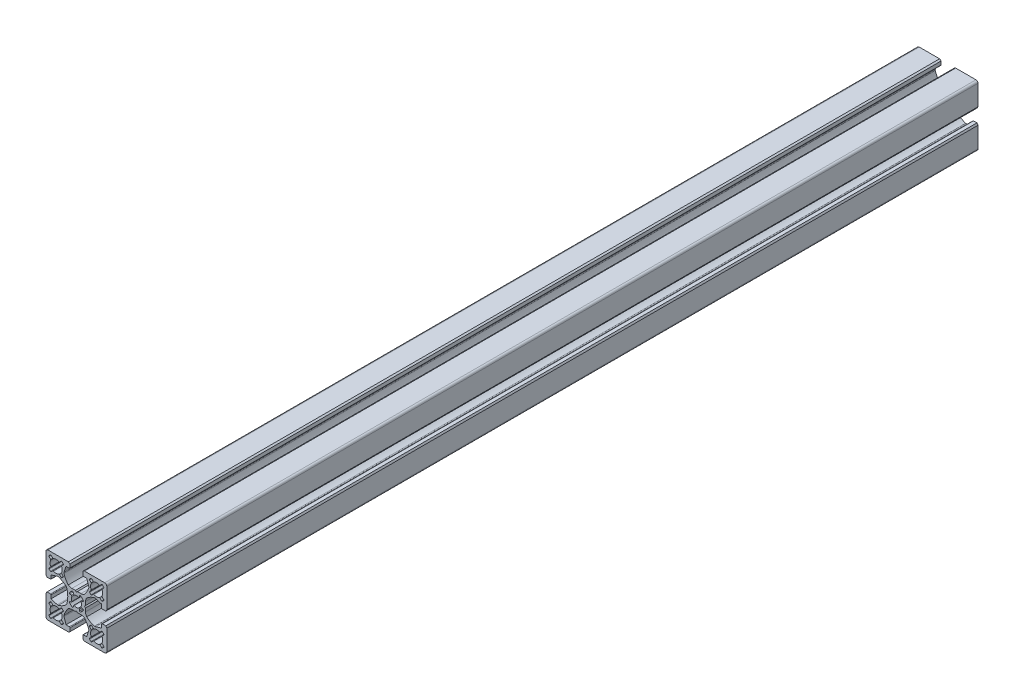
from build123d import *

# Parameters (mm, degrees)
EXTRUDE_1_DEPTH = 430


with BuildPart() as part:
    # Model → 보스-돌출1 (new body)
    with BuildSketch(Plane.XY):
        with BuildLine():
            Line((459.574175407, 182.783831091), (458.774175407, 183.283831091))
            Line((458.774175407, 183.283831091), (458.774175407, 184.983831091))
            ThreePointArc((458.774175407, 184.983831091), (458.862043373, 185.195963125), (459.074175407, 185.283831091))
            Line((459.074175407, 185.283831091), (460.724175407, 185.283831091))
            Line((460.724175407, 185.283831091), (461.711783237, 188.335604532))
            ThreePointArc((461.711783237, 188.335604532), (461.759141443, 188.594081667), (461.737530794, 188.855971354))
            ThreePointArc((461.737530794, 188.855971354), (460.898837663, 190.893750972), (459.628188183, 192.694140329))
            ThreePointArc((459.628188183, 192.694140329), (458.78251429, 193.132596412), (457.842016473, 193.283831091))
            Line((457.842016473, 193.283831091), (456.124175407, 193.283831091))
            Line((456.124175407, 193.283831091), (455.624175407, 193.783831091))
            Line((455.624175407, 193.783831091), (455.124175407, 193.283831091))
            Line((455.124175407, 193.283831091), (453.406334341, 193.283831091))
            ThreePointArc((453.406334341, 193.283831091), (452.465836525, 193.132596412), (451.620162632, 192.694140329))
            ThreePointArc((451.620162632, 192.694140329), (450.349513151, 190.893750972), (449.510820021, 188.855971354))
            ThreePointArc((449.510820021, 188.855971354), (449.489209372, 188.594081667), (449.536567578, 188.335604532))
            Line((449.536567578, 188.335604532), (450.524175407, 185.283831091))
            Line((450.524175407, 185.283831091), (452.174175407, 185.283831091))
            ThreePointArc((452.174175407, 185.283831091), (452.386307442, 185.195963125), (452.474175407, 184.983831091))
            Line((452.474175407, 184.983831091), (452.474175407, 183.283831091))
            Line((452.474175407, 183.283831091), (451.674175407, 182.783831091))
            Line((451.674175407, 182.783831091), (441.624175407, 182.783831091))
            ThreePointArc((441.624175407, 182.783831091), (440.917068626, 183.076724309), (440.624175407, 183.783831091))
            Line((440.624175407, 183.783831091), (440.624175407, 193.833831091))
            Line((440.624175407, 193.833831091), (441.124175407, 194.633831091))
            Line((441.124175407, 194.633831091), (442.824175407, 194.633831091))
            ThreePointArc((442.824175407, 194.633831091), (443.036307442, 194.545963125), (443.124175407, 194.333831091))
            Line((443.124175407, 194.333831091), (443.124175407, 192.683831091))
            Line((443.124175407, 192.683831091), (446.175948849, 191.696223261))
            ThreePointArc((446.175948849, 191.696223261), (446.434425983, 191.648865055), (446.696315671, 191.670475704))
            ThreePointArc((446.696315671, 191.670475704), (448.734095289, 192.509168835), (450.534484646, 193.779818315))
            ThreePointArc((450.534484646, 193.779818315), (450.972940729, 194.625492208), (451.124175407, 195.565990025))
            Line((451.124175407, 195.565990025), (451.124175407, 197.283831091))
            Line((451.124175407, 197.283831091), (451.624175407, 197.783831091))
            Line((451.624175407, 197.783831091), (451.124175407, 198.283831091))
            Line((451.124175407, 198.283831091), (451.124175407, 200.001672157))
            ThreePointArc((451.124175407, 200.001672157), (450.972940729, 200.942169973), (450.534484646, 201.787843866))
            ThreePointArc((450.534484646, 201.787843866), (448.734095289, 203.058493347), (446.696315671, 203.897186477))
            ThreePointArc((446.696315671, 203.897186477), (446.434425983, 203.918797126), (446.175948849, 203.87143892))
            Line((446.175948849, 203.87143892), (443.124175407, 202.883831091))
            Line((443.124175407, 202.883831091), (443.124175407, 201.233831091))
            ThreePointArc((443.124175407, 201.233831091), (443.036307442, 201.021699056), (442.824175407, 200.933831091))
            Line((442.824175407, 200.933831091), (441.124175407, 200.933831091))
            Line((441.124175407, 200.933831091), (440.624175407, 201.733831091))
            Line((440.624175407, 201.733831091), (440.624175407, 211.783831091))
            ThreePointArc((440.624175407, 211.783831091), (440.917068626, 212.490937872), (441.624175407, 212.783831091))
            Line((441.624175407, 212.783831091), (451.674175407, 212.783831091))
            Line((451.674175407, 212.783831091), (452.474175407, 212.283831091))
            Line((452.474175407, 212.283831091), (452.474175407, 210.583831091))
            ThreePointArc((452.474175407, 210.583831091), (452.386307442, 210.371699056), (452.174175407, 210.283831091))
            Line((452.174175407, 210.283831091), (450.524175407, 210.283831091))
            Line((450.524175407, 210.283831091), (449.536567578, 207.232057649))
            ThreePointArc((449.536567578, 207.232057649), (449.489209372, 206.973580515), (449.510820021, 206.711690827))
            ThreePointArc((449.510820021, 206.711690827), (450.349513151, 204.673911209), (451.620162632, 202.873521852))
            ThreePointArc((451.620162632, 202.873521852), (452.465836525, 202.435065769), (453.406334341, 202.283831091))
            Line((453.406334341, 202.283831091), (455.124175407, 202.283831091))
            Line((455.124175407, 202.283831091), (455.624175407, 201.783831091))
            Line((455.624175407, 201.783831091), (456.124175407, 202.283831091))
            Line((456.124175407, 202.283831091), (457.842016473, 202.283831091))
            ThreePointArc((457.842016473, 202.283831091), (458.78251429, 202.435065769), (459.628188183, 202.873521852))
            ThreePointArc((459.628188183, 202.873521852), (460.898837663, 204.673911209), (461.737530794, 206.711690827))
            ThreePointArc((461.737530794, 206.711690827), (461.759141443, 206.973580515), (461.711783237, 207.232057649))
            Line((461.711783237, 207.232057649), (460.724175407, 210.283831091))
            Line((460.724175407, 210.283831091), (459.074175407, 210.283831091))
            ThreePointArc((459.074175407, 210.283831091), (458.862043373, 210.371699056), (458.774175407, 210.583831091))
            Line((458.774175407, 210.583831091), (458.774175407, 212.283831091))
            Line((458.774175407, 212.283831091), (459.574175407, 212.783831091))
            Line((459.574175407, 212.783831091), (469.624175407, 212.783831091))
            ThreePointArc((469.624175407, 212.783831091), (470.331282189, 212.490937872), (470.624175407, 211.783831091))
            Line((470.624175407, 211.783831091), (470.624175407, 201.733831091))
            Line((470.624175407, 201.733831091), (470.124175407, 200.933831091))
            Line((470.124175407, 200.933831091), (468.424175407, 200.933831091))
            ThreePointArc((468.424175407, 200.933831091), (468.212043373, 201.021699056), (468.124175407, 201.233831091))
            Line((468.124175407, 201.233831091), (468.124175407, 202.883831091))
            Line((468.124175407, 202.883831091), (465.072401966, 203.87143892))
            ThreePointArc((465.072401966, 203.87143892), (464.813924831, 203.918797126), (464.552035144, 203.897186477))
            ThreePointArc((464.552035144, 203.897186477), (462.514255526, 203.058493347), (460.713866169, 201.787843866))
            ThreePointArc((460.713866169, 201.787843866), (460.275410086, 200.942169973), (460.124175407, 200.001672157))
            Line((460.124175407, 200.001672157), (460.124175407, 198.283831091))
            Line((460.124175407, 198.283831091), (459.624175407, 197.783831091))
            Line((459.624175407, 197.783831091), (460.124175407, 197.283831091))
            Line((460.124175407, 197.283831091), (460.124175407, 195.565990025))
            ThreePointArc((460.124175407, 195.565990025), (460.275410086, 194.625492208), (460.713866169, 193.779818315))
            ThreePointArc((460.713866169, 193.779818315), (462.514255526, 192.509168835), (464.552035144, 191.670475704))
            ThreePointArc((464.552035144, 191.670475704), (464.813924831, 191.648865055), (465.072401966, 191.696223261))
            Line((465.072401966, 191.696223261), (468.124175407, 192.683831091))
            Line((468.124175407, 192.683831091), (468.124175407, 194.333831091))
            ThreePointArc((468.124175407, 194.333831091), (468.212043373, 194.545963125), (468.424175407, 194.633831091))
            Line((468.424175407, 194.633831091), (470.124175407, 194.633831091))
            Line((470.124175407, 194.633831091), (470.624175407, 193.833831091))
            Line((470.624175407, 193.833831091), (470.624175407, 183.783831091))
            ThreePointArc((470.624175407, 183.783831091), (470.331282189, 183.076724309), (469.624175407, 182.783831091))
            Line((469.624175407, 182.783831091), (459.574175407, 182.783831091))
        make_face()
        with BuildLine():
            Line((462.879323242, 206.101978996), (462.138752469, 205.361408224))
            ThreePointArc((462.138752469, 205.361408224), (462.051316542, 205.165370796), (462.117245146, 204.961093696))
            ThreePointArc((462.117245146, 204.961093696), (462.439854993, 204.601850575), (462.799098114, 204.279240729))
            ThreePointArc((462.799098114, 204.279240729), (463.003375214, 204.213312125), (463.199412641, 204.300748052))
            Line((463.199412641, 204.300748052), (463.939983413, 205.041318824))
            ThreePointArc((463.939983413, 205.041318824), (464.103755722, 205.125263363), (464.285726362, 205.097790817))
            ThreePointArc((464.285726362, 205.097790817), (465.621835508, 204.783831091), (466.957944654, 205.097790817))
            ThreePointArc((466.957944654, 205.097790817), (467.139915294, 205.125263363), (467.303687603, 205.041318824))
            Line((467.303687603, 205.041318824), (468.044258375, 204.300748052))
            ThreePointArc((468.044258375, 204.300748052), (468.240295802, 204.213312125), (468.444572902, 204.279240729))
            ThreePointArc((468.444572902, 204.279240729), (468.803816023, 204.601850575), (469.12642587, 204.961093696))
            ThreePointArc((469.12642587, 204.961093696), (469.192354474, 205.165370796), (469.104918547, 205.361408224))
            Line((469.104918547, 205.361408224), (468.364347775, 206.101978996))
            ThreePointArc((468.364347775, 206.101978996), (468.280403236, 206.265751305), (468.307875782, 206.447721945))
            ThreePointArc((468.307875782, 206.447721945), (468.621835508, 207.783831091), (468.307875782, 209.119940236))
            ThreePointArc((468.307875782, 209.119940236), (468.280403236, 209.301910877), (468.364347774, 209.465683185))
            Line((468.364347774, 209.465683185), (469.104918547, 210.206253957))
            ThreePointArc((469.104918547, 210.206253957), (469.192354474, 210.402291385), (469.12642587, 210.606568485))
            ThreePointArc((469.12642587, 210.606568485), (468.803816023, 210.965811606), (468.444572902, 211.288421452))
            ThreePointArc((468.444572902, 211.288421452), (468.240295802, 211.354350057), (468.044258375, 211.266914129))
            Line((468.044258375, 211.266914129), (467.303687603, 210.526343357))
            ThreePointArc((467.303687603, 210.526343357), (467.139915294, 210.442398819), (466.957944654, 210.469871364))
            ThreePointArc((466.957944654, 210.469871364), (465.621835508, 210.783831091), (464.285726362, 210.469871364))
            ThreePointArc((464.285726362, 210.469871364), (464.103755722, 210.442398819), (463.939983413, 210.526343357))
            Line((463.939983413, 210.526343357), (463.199412641, 211.266914129))
            ThreePointArc((463.199412641, 211.266914129), (463.003375214, 211.354350057), (462.799098114, 211.288421452))
            ThreePointArc((462.799098114, 211.288421452), (462.439854993, 210.965811606), (462.117245146, 210.606568485))
            ThreePointArc((462.117245146, 210.606568485), (462.051316542, 210.402291385), (462.138752469, 210.206253957))
            Line((462.138752469, 210.206253957), (462.879323242, 209.465683185))
            ThreePointArc((462.879323242, 209.465683185), (462.96326778, 209.301910877), (462.935795235, 209.119940236))
            ThreePointArc((462.935795235, 209.119940236), (462.621835508, 207.783831091), (462.935795235, 206.447721945))
            ThreePointArc((462.935795235, 206.447721945), (462.96326778, 206.265751305), (462.879323242, 206.101978996))
        make_face(mode=Mode.SUBTRACT)
        with BuildLine():
            Line((462.878674407, 189.465117129), (462.138161401, 190.205745663))
            ThreePointArc((462.138161401, 190.205745663), (462.050740765, 190.40178991), (462.116685302, 190.606061867))
            ThreePointArc((462.116685302, 190.606061867), (462.439323169, 190.965279823), (462.798591452, 191.287861648))
            ThreePointArc((462.798591452, 191.287861648), (463.002873694, 191.353774318), (463.198904301, 191.2663231))
            Line((463.198904301, 191.2663231), (463.939417306, 190.525694566))
            ThreePointArc((463.939417306, 190.525694566), (464.103183067, 190.441737254), (464.285155849, 190.469195606))
            ThreePointArc((464.285155849, 190.469195606), (465.62128948, 190.783051115), (466.957374133, 190.468987173))
            ThreePointArc((466.957374133, 190.468987173), (467.13934263, 190.441500434), (467.303121485, 190.525432198))
            Line((467.303121485, 190.525432198), (468.04375002, 191.265945204))
            ThreePointArc((468.04375002, 191.265945204), (468.239794266, 191.35336584), (468.444066223, 191.287421303))
            ThreePointArc((468.444066223, 191.287421303), (468.80328418, 190.964783436), (469.125866004, 190.605515153))
            ThreePointArc((469.125866004, 190.605515153), (469.191778675, 190.401232911), (469.104327457, 190.205202304))
            Line((469.104327457, 190.205202304), (468.363698923, 189.464689299))
            ThreePointArc((468.363698923, 189.464689299), (468.27974161, 189.300923538), (468.307199962, 189.118950756))
            ThreePointArc((468.307199962, 189.118950756), (468.621055472, 187.782817125), (468.30699153, 186.446732472))
            ThreePointArc((468.30699153, 186.446732472), (468.279504791, 186.264763975), (468.363436555, 186.100985119))
            Line((468.363436555, 186.100985119), (469.103949561, 185.360356585))
            ThreePointArc((469.103949561, 185.360356585), (469.191370197, 185.164312338), (469.125425659, 184.960040382))
            ThreePointArc((469.125425659, 184.960040382), (468.802787793, 184.600822425), (468.443519509, 184.2782406))
            ThreePointArc((468.443519509, 184.2782406), (468.239237268, 184.21232793), (468.043206661, 184.299779148))
            Line((468.043206661, 184.299779148), (467.302693655, 185.040407682))
            ThreePointArc((467.302693655, 185.040407682), (467.138927895, 185.124364994), (466.956955112, 185.096906643))
            ThreePointArc((466.956955112, 185.096906643), (465.620821482, 184.783051133), (464.284736829, 185.097115075))
            ThreePointArc((464.284736829, 185.097115075), (464.102768332, 185.124601814), (463.938989476, 185.04067005))
            Line((463.938989476, 185.04067005), (463.198360942, 184.300157044))
            ThreePointArc((463.198360942, 184.300157044), (463.002316695, 184.212736408), (462.798044738, 184.278680946))
            ThreePointArc((462.798044738, 184.278680946), (462.438826782, 184.601318812), (462.116244957, 184.960587096))
            ThreePointArc((462.116244957, 184.960587096), (462.050332287, 185.164869337), (462.137783504, 185.360899944))
            Line((462.137783504, 185.360899944), (462.878412039, 186.10141295))
            ThreePointArc((462.878412039, 186.10141295), (462.962369351, 186.26517871), (462.934910999, 186.447151493))
            ThreePointArc((462.934910999, 186.447151493), (462.62105549, 187.783285123), (462.935119432, 189.119369776))
            ThreePointArc((462.935119432, 189.119369776), (462.962606171, 189.301338273), (462.878674407, 189.465117129))
        make_face(mode=Mode.SUBTRACT)
        with BuildLine():
            Line((448.367336509, 189.465117129), (449.107849514, 190.205745663))
            ThreePointArc((449.107849514, 190.205745663), (449.195270151, 190.40178991), (449.129325613, 190.606061867))
            ThreePointArc((449.129325613, 190.606061867), (448.806687747, 190.965279823), (448.447419463, 191.287861648))
            ThreePointArc((448.447419463, 191.287861648), (448.243137222, 191.353774318), (448.047106615, 191.2663231))
            Line((448.047106615, 191.2663231), (447.306593609, 190.525694566))
            ThreePointArc((447.306593609, 190.525694566), (447.142827848, 190.441737254), (446.960855066, 190.469195606))
            ThreePointArc((446.960855066, 190.469195606), (445.624721436, 190.783051115), (444.288636783, 190.468987173))
            ThreePointArc((444.288636783, 190.468987173), (444.106668286, 190.441500434), (443.94288943, 190.525432198))
            Line((443.94288943, 190.525432198), (443.202260896, 191.265945204))
            ThreePointArc((443.202260896, 191.265945204), (443.006216649, 191.35336584), (442.801944692, 191.287421303))
            ThreePointArc((442.801944692, 191.287421303), (442.442726735, 190.964783436), (442.120144911, 190.605515153))
            ThreePointArc((442.120144911, 190.605515153), (442.054232241, 190.401232911), (442.141683458, 190.205202304))
            Line((442.141683458, 190.205202304), (442.882311993, 189.464689299))
            ThreePointArc((442.882311993, 189.464689299), (442.966269305, 189.300923538), (442.938810953, 189.118950756))
            ThreePointArc((442.938810953, 189.118950756), (442.624955444, 187.782817125), (442.939019385, 186.446732472))
            ThreePointArc((442.939019385, 186.446732472), (442.966506124, 186.264763975), (442.88257436, 186.100985119))
            Line((442.88257436, 186.100985119), (442.142061355, 185.360356585))
            ThreePointArc((442.142061355, 185.360356585), (442.054640719, 185.164312338), (442.120585256, 184.960040382))
            ThreePointArc((442.120585256, 184.960040382), (442.443223122, 184.600822425), (442.802491406, 184.2782406))
            ThreePointArc((442.802491406, 184.2782406), (443.006773648, 184.21232793), (443.202804255, 184.299779148))
            Line((443.202804255, 184.299779148), (443.94331726, 185.040407682))
            ThreePointArc((443.94331726, 185.040407682), (444.107083021, 185.124364994), (444.289055803, 185.096906643))
            ThreePointArc((444.289055803, 185.096906643), (445.625189434, 184.783051133), (446.961274087, 185.097115075))
            ThreePointArc((446.961274087, 185.097115075), (447.143242583, 185.124601814), (447.307021439, 185.04067005))
            Line((447.307021439, 185.04067005), (448.047649974, 184.300157044))
            ThreePointArc((448.047649974, 184.300157044), (448.24369422, 184.212736408), (448.447966177, 184.278680946))
            ThreePointArc((448.447966177, 184.278680946), (448.807184134, 184.601318812), (449.129765958, 184.960587096))
            ThreePointArc((449.129765958, 184.960587096), (449.195678629, 185.164869337), (449.108227411, 185.360899944))
            Line((449.108227411, 185.360899944), (448.367598877, 186.10141295))
            ThreePointArc((448.367598877, 186.10141295), (448.283641564, 186.26517871), (448.311099916, 186.447151493))
            ThreePointArc((448.311099916, 186.447151493), (448.624955426, 187.783285123), (448.310891484, 189.119369776))
            ThreePointArc((448.310891484, 189.119369776), (448.283404745, 189.301338273), (448.367336509, 189.465117129))
        make_face(mode=Mode.SUBTRACT)
        with BuildLine():
            Line((457.210300672, 201.021172973), (457.076729929, 200.280239327))
            ThreePointArc((457.076729929, 200.280239327), (456.920864875, 200.06780508), (456.657491136, 200.060288559))
            ThreePointArc((456.657491136, 200.060288559), (455.624175407, 200.283831091), (454.590859679, 200.060288559))
            ThreePointArc((454.590859679, 200.060288559), (454.32748594, 200.06780508), (454.171620886, 200.280239327))
            Line((454.171620886, 200.280239327), (454.038050143, 201.021172973))
            ThreePointArc((454.038050143, 201.021172973), (453.867687152, 201.240722573), (453.590171174, 201.226215416))
            ThreePointArc((453.590171174, 201.226215416), (452.796918232, 200.611088266), (452.181791082, 199.817835324))
            ThreePointArc((452.181791082, 199.817835324), (452.167283925, 199.540319346), (452.386833525, 199.369956355))
            Line((452.386833525, 199.369956355), (453.127767171, 199.236385612))
            ThreePointArc((453.127767171, 199.236385612), (453.340201418, 199.080520558), (453.347717939, 198.817146819))
            ThreePointArc((453.347717939, 198.817146819), (453.124175407, 197.783831091), (453.347717939, 196.750515362))
            ThreePointArc((453.347717939, 196.750515362), (453.340201418, 196.487141623), (453.127767171, 196.331276569))
            Line((453.127767171, 196.331276569), (452.386833525, 196.197705826))
            ThreePointArc((452.386833525, 196.197705826), (452.167283925, 196.027342835), (452.181791082, 195.749826857))
            ThreePointArc((452.181791082, 195.749826857), (452.796918232, 194.956573915), (453.590171174, 194.341446765))
            ThreePointArc((453.590171174, 194.341446765), (453.867687152, 194.326939608), (454.038050143, 194.546489208))
            Line((454.038050143, 194.546489208), (454.171620886, 195.287422854))
            ThreePointArc((454.171620886, 195.287422854), (454.32748594, 195.499857101), (454.590859679, 195.507373622))
            ThreePointArc((454.590859679, 195.507373622), (455.624175407, 195.283831091), (456.657491136, 195.507373622))
            ThreePointArc((456.657491136, 195.507373622), (456.920864875, 195.499857101), (457.076729929, 195.287422854))
            Line((457.076729929, 195.287422854), (457.210300672, 194.546489208))
            ThreePointArc((457.210300672, 194.546489208), (457.380663663, 194.326939608), (457.658179641, 194.341446765))
            ThreePointArc((457.658179641, 194.341446765), (458.451432582, 194.956573915), (459.066559733, 195.749826857))
            ThreePointArc((459.066559733, 195.749826857), (459.08106689, 196.027342835), (458.86151729, 196.197705826))
            Line((458.86151729, 196.197705826), (458.120583644, 196.331276569))
            ThreePointArc((458.120583644, 196.331276569), (457.908149397, 196.487141623), (457.900632876, 196.750515362))
            ThreePointArc((457.900632876, 196.750515362), (458.124175407, 197.783831091), (457.900632876, 198.817146819))
            ThreePointArc((457.900632876, 198.817146819), (457.908149397, 199.080520558), (458.120583644, 199.236385612))
            Line((458.120583644, 199.236385612), (458.86151729, 199.369956355))
            ThreePointArc((458.86151729, 199.369956355), (459.08106689, 199.540319346), (459.066559733, 199.817835324))
            ThreePointArc((459.066559733, 199.817835324), (458.451432582, 200.611088266), (457.658179641, 201.226215416))
            ThreePointArc((457.658179641, 201.226215416), (457.380663663, 201.240722573), (457.210300672, 201.021172973))
        make_face(mode=Mode.SUBTRACT)
        with BuildLine():
            Line((448.366687674, 206.101978996), (449.107258446, 205.361408224))
            ThreePointArc((449.107258446, 205.361408224), (449.194694373, 205.165370796), (449.128765769, 204.961093696))
            ThreePointArc((449.128765769, 204.961093696), (448.806155923, 204.601850575), (448.446912802, 204.279240729))
            ThreePointArc((448.446912802, 204.279240729), (448.242635702, 204.213312125), (448.046598274, 204.300748052))
            Line((448.046598274, 204.300748052), (447.306027502, 205.041318824))
            ThreePointArc((447.306027502, 205.041318824), (447.142255193, 205.125263363), (446.960284553, 205.097790817))
            ThreePointArc((446.960284553, 205.097790817), (445.624175407, 204.783831091), (444.288066262, 205.097790817))
            ThreePointArc((444.288066262, 205.097790817), (444.106095621, 205.125263363), (443.942323313, 205.041318824))
            Line((443.942323313, 205.041318824), (443.20175254, 204.300748052))
            ThreePointArc((443.20175254, 204.300748052), (443.005715113, 204.213312125), (442.801438013, 204.279240729))
            ThreePointArc((442.801438013, 204.279240729), (442.442194892, 204.601850575), (442.119585046, 204.961093696))
            ThreePointArc((442.119585046, 204.961093696), (442.053656441, 205.165370796), (442.141092369, 205.361408224))
            Line((442.141092369, 205.361408224), (442.881663141, 206.101978996))
            ThreePointArc((442.881663141, 206.101978996), (442.965607679, 206.265751305), (442.938135134, 206.447721945))
            ThreePointArc((442.938135134, 206.447721945), (442.624175407, 207.783831091), (442.938135134, 209.119940236))
            ThreePointArc((442.938135134, 209.119940236), (442.965607679, 209.301910877), (442.881663141, 209.465683185))
            Line((442.881663141, 209.465683185), (442.141092369, 210.206253957))
            ThreePointArc((442.141092369, 210.206253957), (442.053656441, 210.402291385), (442.119585046, 210.606568485))
            ThreePointArc((442.119585046, 210.606568485), (442.442194892, 210.965811606), (442.801438013, 211.288421452))
            ThreePointArc((442.801438013, 211.288421452), (443.005715113, 211.354350057), (443.20175254, 211.266914129))
            Line((443.20175254, 211.266914129), (443.942323313, 210.526343357))
            ThreePointArc((443.942323313, 210.526343357), (444.106095621, 210.442398819), (444.288066262, 210.469871364))
            ThreePointArc((444.288066262, 210.469871364), (445.624175407, 210.783831091), (446.960284553, 210.469871364))
            ThreePointArc((446.960284553, 210.469871364), (447.142255193, 210.442398819), (447.306027502, 210.526343357))
            Line((447.306027502, 210.526343357), (448.046598274, 211.266914129))
            ThreePointArc((448.046598274, 211.266914129), (448.242635702, 211.354350056), (448.446912802, 211.288421452))
            ThreePointArc((448.446912802, 211.288421452), (448.806155923, 210.965811606), (449.128765769, 210.606568485))
            ThreePointArc((449.128765769, 210.606568485), (449.194694373, 210.402291385), (449.107258446, 210.206253957))
            Line((449.107258446, 210.206253957), (448.366687674, 209.465683185))
            ThreePointArc((448.366687674, 209.465683185), (448.282743135, 209.301910877), (448.310215681, 209.119940236))
            ThreePointArc((448.310215681, 209.119940236), (448.624175407, 207.783831091), (448.310215681, 206.447721945))
            ThreePointArc((448.310215681, 206.447721945), (448.282743135, 206.265751305), (448.366687674, 206.101978996))
        make_face(mode=Mode.SUBTRACT)
    extrude(amount=EXTRUDE_1_DEPTH)


solid = part.part
